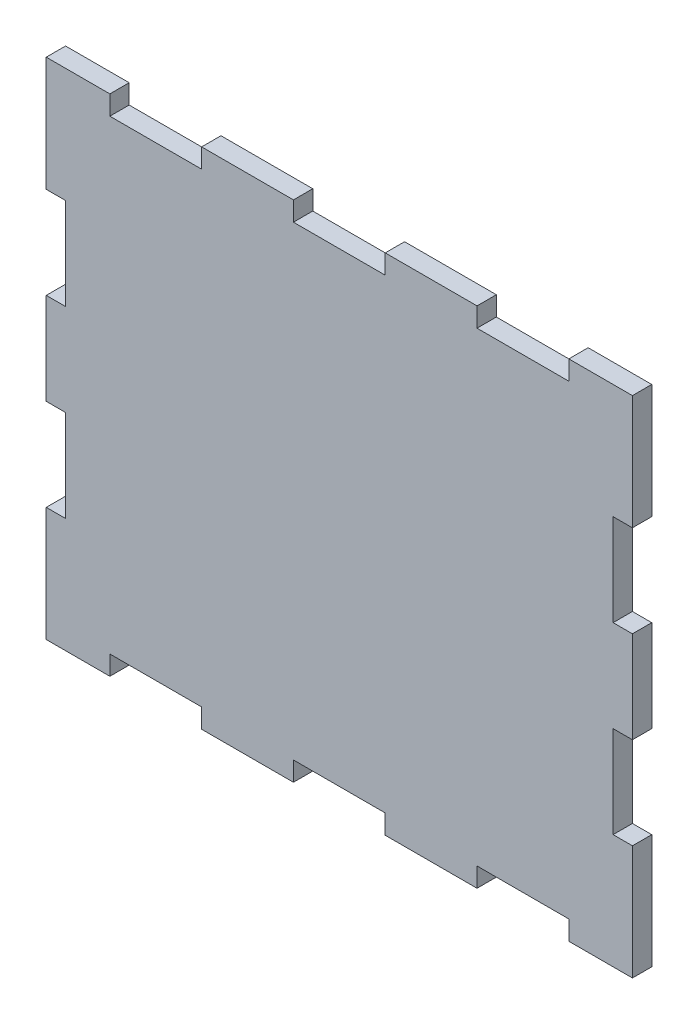
from build123d import *

# Parameters (mm, degrees)
BOSS_EXTRUDE1_DEPTH = 3


with BuildPart() as part:
    # Sketch1 → Boss-Extrude1 (new body)
    with BuildSketch(Plane.XY):
        Polygon((-43.15917125, 37.329355417), (-43.15917125, 19.554355417), (-40.15917125, 19.554355417), (-40.15917125, 5.304355417), (-43.15917125, 5.304355417), (-43.15917125, -8.945644583), (-40.15917125, -8.945644583), (-40.15917125, -23.195644583), (-43.15917125, -23.195644583), (-43.15917125, -37.445644583), (-43.15917125, -40.970644583), (-33.28417125, -40.970644583), (-33.28417125, -37.970644583), (-19.03417125, -37.970644583), (-19.03417125, -40.970644583), (-4.78417125, -40.970644583), (-4.78417125, -37.970644583), (9.46582875, -37.970644583), (9.46582875, -40.970644583), (23.71582875, -40.970644583), (23.71582875, -37.970644583), (37.96582875, -37.970644583), (37.96582875, -40.970644583), (47.84082875, -40.970644583), (47.84082875, -23.195644583), (44.84082875, -23.195644583), (44.84082875, -8.945644583), (47.84082875, -8.945644583), (47.84082875, 5.304355417), (44.84082875, 5.304355417), (44.84082875, 19.554355417), (47.84082875, 19.554355417), (47.84082875, 33.804355417), (47.84082875, 37.329355417), (37.96582875, 37.329355417), (37.96582875, 34.329355417), (23.71582875, 34.329355417), (23.71582875, 37.329355417), (9.46582875, 37.329355417), (9.46582875, 34.329355417), (-4.78417125, 34.329355417), (-4.78417125, 37.329355417), (-19.03417125, 37.329355417), (-19.03417125, 34.329355417), (-33.28417125, 34.329355417), (-33.28417125, 37.329355417), align=None)
    extrude(amount=BOSS_EXTRUDE1_DEPTH)


solid = part.part
